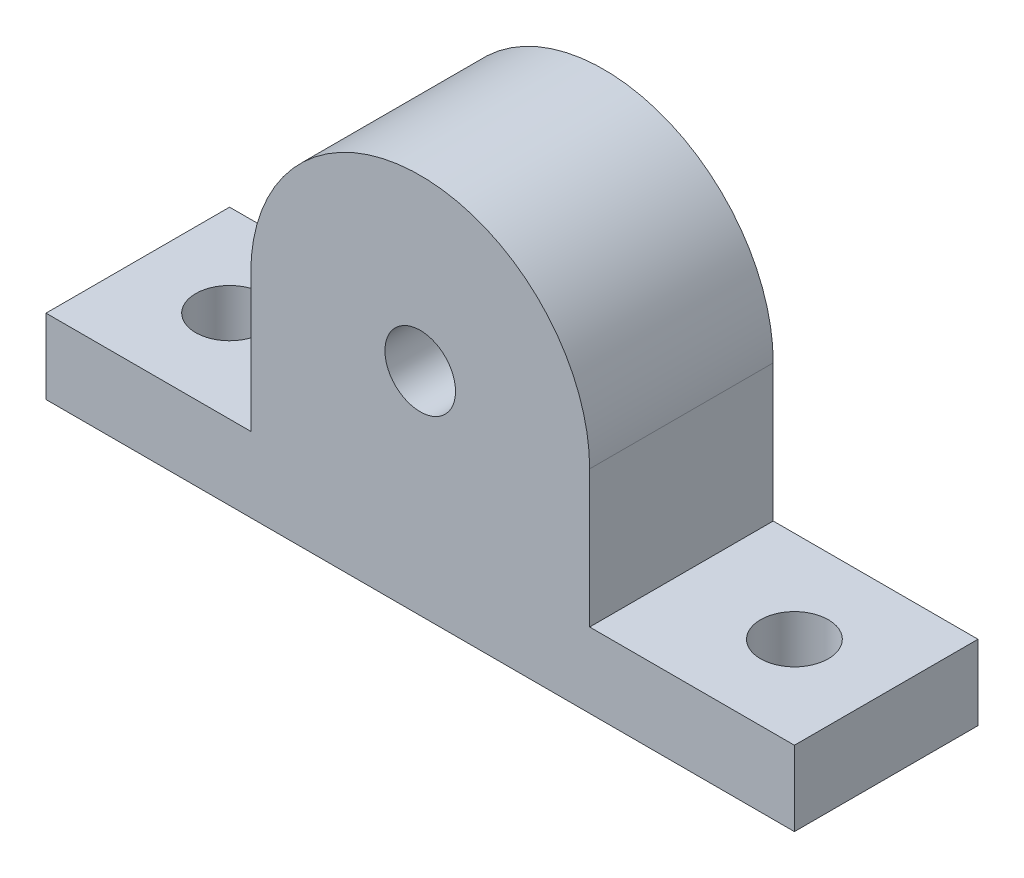
from build123d import *

# Parameters (mm, degrees)
EXTRUDE_1_DEPTH     = 13
SKETCH_2_R          = 2.5
CUT_EXTRUDE_1_DEPTH = 13
SKETCH_3_R          = 2.4
CUT_EXTRUDE_2_DEPTH = 13


with BuildPart() as part:
    # 草图1 → 凸台-拉伸1 (new body)
    with BuildSketch(Plane.XY):
        with BuildLine():
            Line((-12, -9.7), (-26.5, -9.7))
            Line((-26.5, -9.7), (-26.5, -15))
            Line((-26.5, -15), (26.5, -15))
            Line((26.5, -15), (26.5, -9.7))
            Line((26.5, -9.7), (12, -9.7))
            Line((12, -9.7), (12, 0))
            ThreePointArc((12, 0), (0, 12), (-12, 0))
            Line((-12, 0), (-12, -9.7))
        make_face()
    extrude(amount=EXTRUDE_1_DEPTH)

    # 草图2 → 切除-拉伸1 (cut)
    with BuildSketch(Plane.XY.offset(13)):
        Circle(SKETCH_2_R)
    extrude(amount=-CUT_EXTRUDE_1_DEPTH, mode=Mode.SUBTRACT)

    # 草图3 → 切除-拉伸2 (cut)
    with BuildSketch(Plane(origin=(0, -9.7, 0), x_dir=(1, 0, 0), z_dir=(0, 1, 0))):
        with Locations(Location((20, -6.5, 0), (0, 0, 180))):
            Circle(SKETCH_3_R)
        with Locations(Location((-20, -6.5, 0), (0, 0, 180))):
            Circle(SKETCH_3_R)
    extrude(amount=-CUT_EXTRUDE_2_DEPTH, mode=Mode.SUBTRACT)


solid = part.part
